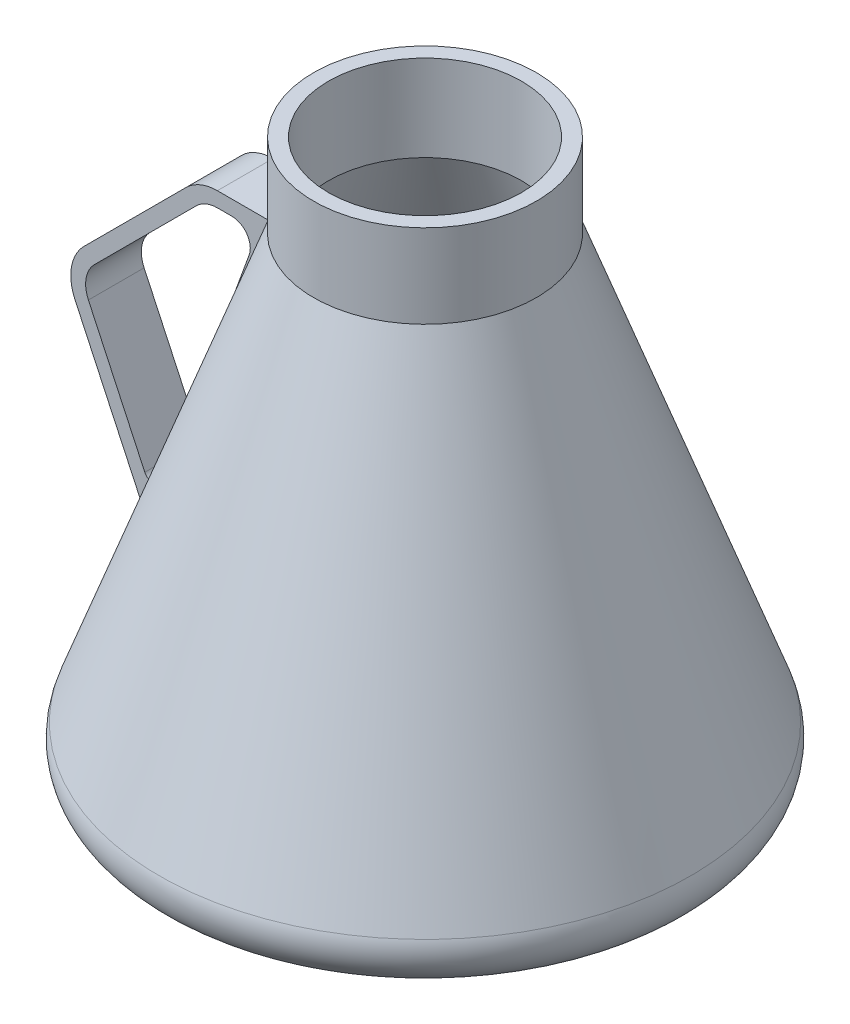
from build123d import *

# Parameters (mm, degrees)
SKETCH_2_R          = 52
CUT_EXTRUDE_1_DEPTH = 292
EXTRUDE_2_DEPTH     = 15
FILLET_1_R          = 10
FILLET_2_R          = 5
FILLET_3_R          = 5


with BuildPart() as part:
    # 草图1 → 旋转2 (revolve)
    with BuildSketch(Plane.XY, mode=Mode.PRIVATE) as revolve_2_sk:
        with BuildLine():
            Line((0, 0), (-124.249449603, 0))
            ThreePointArc((-124.249449603, 0), (-140.632490489, 8.528471273), (-143.043302019, 26.840402867))
            Line((-143.043302019, 26.840402867), (-60, 255))
            Line((-60, 255), (-60, 300))
            Line((-60, 300), (0, 300))
            Line((0, 300), (0, 0))
        make_face()
        with BuildLine():
            Line((-8, 8), (-124.249449603, 8))
            ThreePointArc((-124.249449603, 8), (-134.079274135, 13.117082764), (-135.525761052, 24.10424172))
            Line((-135.525761052, 24.10424172), (-52, 253.589384154))
            Line((-52, 253.589384154), (-52, 292))
            Line((-52, 292), (-8, 292))
            Line((-8, 292), (-8, 8))
        make_face(mode=Mode.SUBTRACT)
    revolve(revolve_2_sk.sketch.rotate(Axis((0, -74.77110885, 0), (0, 1, 0)), 270), axis=Axis((0, -74.77110885, 0), (0, 1, 0)))

    # 草图2 → 切除-拉伸1 (cut)
    with BuildSketch(Plane(origin=(0, 300, 0), x_dir=(1, 0, 0), z_dir=(0, 1, 0))):
        with Locations(Location((0, 0, 0), (0, 0, 90))):
            Circle(SKETCH_2_R)
    extrude(amount=-CUT_EXTRUDE_1_DEPTH, mode=Mode.SUBTRACT)

    # 草图5 → 凸台-拉伸2 (add, symmetric)
    # profile 1 of 2: a face of its own
    with BuildSketch(Plane.XY):
        with BuildLine():
            Line((-63.38666383, 234), (-96.814984609, 234))
            ThreePointArc((-96.814984609, 234), (-105.999386986, 232.17310878), (-113.785547358, 226.970562748))
            Line((-113.785547358, 226.970562748), (-168.73593113, 172.020178976))
            ThreePointArc((-168.73593113, 172.020178976), (-175.400754454, 159.217172492), (-173.51675527, 144.906777946))
            Line((-173.51675527, 144.906777946), (-129.876648813, 51.320267637))
            Line((-129.876648813, 51.320267637), (-63.38666383, 234))
        make_face()
        with BuildLine():
            ThreePointArc((-96.814984609, 230), (-104.468653256, 228.47759065), (-110.957120233, 224.142135624))
            Line((-110.957120233, 224.142135624), (-165.907504005, 169.191751851))
            ThreePointArc((-165.907504005, 169.191751851), (-171.461523442, 158.522579781), (-169.891524122, 146.597250993))
            Line((-169.891524122, 146.597250993), (-130.332580622, 61.762822889))
            Line((-130.332580622, 61.762822889), (-69.099255857, 230))
            Line((-69.099255857, 230), (-96.814984609, 230))
        make_face(mode=Mode.SUBTRACT)
    # profile 2 of 2: a face of its own
    with BuildSketch(Plane.XY):
        with BuildLine():
            Line((-69.099255857, 230), (-96.814984609, 230))
            ThreePointArc((-96.814984609, 230), (-104.468653256, 228.47759065), (-110.957120233, 224.142135624))
            Line((-110.957120233, 224.142135624), (-165.907504005, 169.191751851))
            ThreePointArc((-165.907504005, 169.191751851), (-171.461523442, 158.522579781), (-169.891524122, 146.597250993))
            Line((-169.891524122, 146.597250993), (-130.332580622, 61.762822889))
            Line((-130.332580622, 61.762822889), (-69.099255857, 230))
        make_face()
        with BuildLine():
            ThreePointArc((-96.814984609, 226), (-102.937919527, 224.78207252), (-108.128693108, 221.313708499))
            Line((-108.128693108, 221.313708499), (-163.07907688, 166.363324727))
            ThreePointArc((-163.07907688, 166.363324727), (-167.52229243, 157.82798707), (-166.266292974, 148.28772404))
            Line((-166.266292974, 148.28772404), (-130.788512431, 72.20537814))
            Line((-130.788512431, 72.20537814), (-74.811847884, 226))
            Line((-74.811847884, 226), (-96.814984609, 226))
        make_face(mode=Mode.SUBTRACT)
    extrude(amount=EXTRUDE_2_DEPTH, both=True)

    # 圆角1
    fillet_1_edges = [part.edges().sort_by_distance(p)[0] for p in [
        (-74.811847884, 226, 0),
    ]]
    fillet(fillet_1_edges, radius=FILLET_1_R)

    # 圆角2
    fillet_2_edges = [part.edges().sort_by_distance(p)[0] for p in [
        (-130.788512431, 72.20537814, 0),
    ]]
    fillet(fillet_2_edges, radius=FILLET_2_R)

    # 圆角3
    fillet_3_edges = [part.edges().sort_by_distance(p)[0] for p in [
        (-67.64337492, 234, 0),
    ]]
    fillet(fillet_3_edges, radius=FILLET_3_R)


solid = part.part
